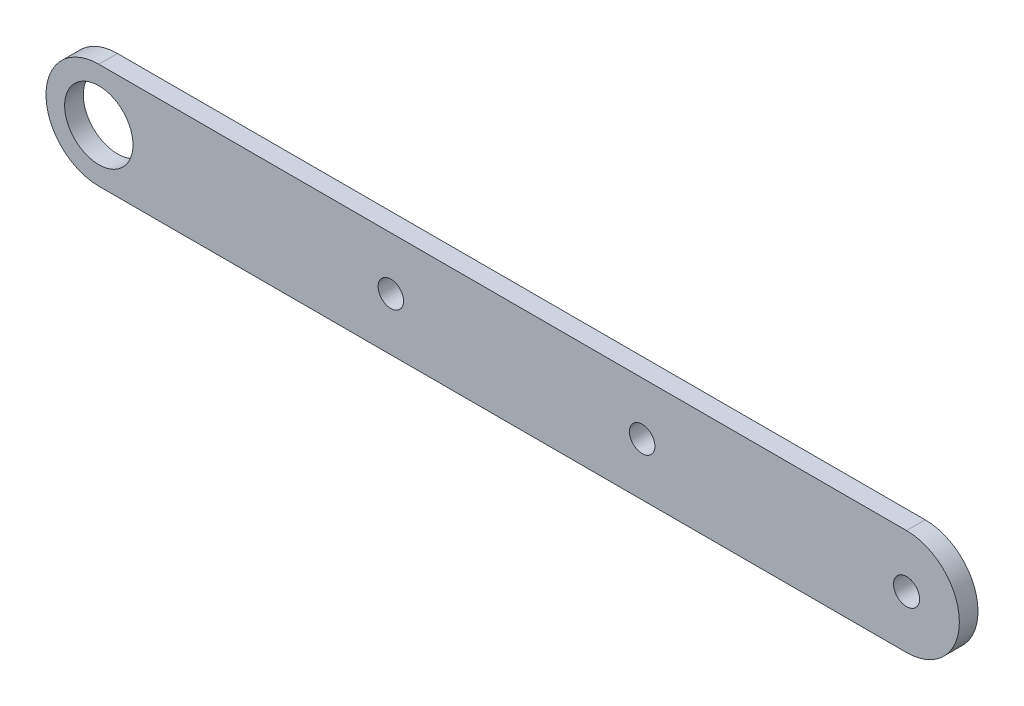
from build123d import *

# Parameters (mm, degrees)
ESQUISSE1_R        = 2.1
ESQUISSE1_R_2      = 5.5
ESQUISSE1_R_3      = 2.05
BOSS_EXTRU_1_DEPTH = 3


with BuildPart() as part:
    # Esquisse1 → Boss.-Extru.1 (new body)
    with BuildSketch(Plane.XY):
        with BuildLine():
            Line((-130, 8.5), (0, 8.5))
            ThreePointArc((0, 8.5), (8.5, 0), (0, -8.5))
            Line((0, -8.5), (-130, -8.5))
            ThreePointArc((-130, -8.5), (-138.5, 0), (-130, 8.5))
        make_face()
        Circle(ESQUISSE1_R, mode=Mode.SUBTRACT)
        with Locations((-130, 0)):
            Circle(ESQUISSE1_R_2, mode=Mode.SUBTRACT)
        with Locations((-83, 0)):
            Circle(ESQUISSE1_R_3, mode=Mode.SUBTRACT)
        with Locations((-42.55, 0)):
            Circle(ESQUISSE1_R_3, mode=Mode.SUBTRACT)
    extrude(amount=BOSS_EXTRU_1_DEPTH)


solid = part.part
